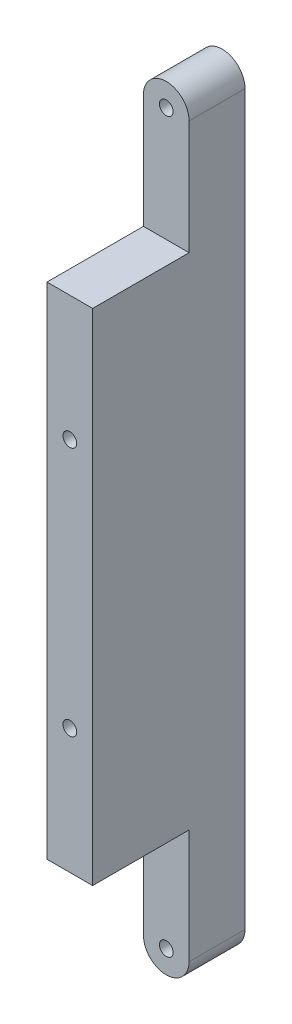
from build123d import *

# Parameters (mm, degrees)
SKETCH_1_R          = 2
SKETCH_1_R_2        = 0.6
EXTRUDE_1_DEPTH     = 20
SKETCH_4_W          = 4
SKETCH_4_H          = 20
EXTRUDE_2_DEPTH     = 10
SKETCH_3_W          = 4
SKETCH_3_H          = 10.2
CUT_EXTRUDE_1_DEPTH = 24.409399821
EXTRUDE_START       = 10
SKETCH_4_2_W        = 4
SKETCH_4_2_H        = 20
EXTRUDE_3_DEPTH     = 3
SKETCH_1_4_R        = 0.6
CUT_EXTRUDE_3_DEPTH = 24.937418407
SKETCH_5_W          = 4
SKETCH_5_H          = 18.9
EXTRUDE_4_DEPTH     = 20
SKETCH_6_W          = 6.65
SKETCH_6_H          = 67.8
CUT_EXTRUDE_4_DEPTH = 69.888605734
SKETCH_7_R          = 0.6
CUT_EXTRUDE_5_DEPTH = 3


with BuildPart() as part:
    # 草图1 → 凸台-拉伸1 (new body)
    with BuildSketch(Plane.XY):
        Circle(SKETCH_1_R)
        Circle(SKETCH_1_R_2, mode=Mode.SUBTRACT)
    extrude(amount=EXTRUDE_1_DEPTH)

    # 草图4 → 凸台-拉伸2 (add)
    with BuildSketch(Plane(origin=(0, 0, 0), x_dir=(1, 0, 0), z_dir=(0, 1, 0))):
        with Locations((0, -10)):
            Rectangle(SKETCH_4_W, SKETCH_4_H)
    extrude(amount=EXTRUDE_2_DEPTH)

    # 草图3 → 切除-拉伸1 (cut, through all)
    with BuildSketch(Plane(origin=(0, 10, 0), x_dir=(1, 0, 0), z_dir=(0, 1, 0))):
        with Locations((0, -10)):
            Rectangle(SKETCH_3_W, SKETCH_3_H)
    extrude(amount=-CUT_EXTRUDE_1_DEPTH, mode=Mode.SUBTRACT)


with BuildPart() as cut_extrude_1_piece_1:
    # of the separate pieces the step leaves, piece 1, a body of its own (cut_extrude_1_pieces)
    add(part.part.solids().sort_by_distance((-2, 0, 0))[0])



with BuildPart() as cut_extrude_1_piece_2:
    # of the separate pieces the step leaves, piece 2, a body of its own (cut_extrude_1_pieces)
    add(part.part.solids().sort_by_distance((2, 0, 15.1))[0])


with BuildPart() as cut_extrude_1_piece_1_1:
    add(cut_extrude_1_piece_1.part)

    add(cut_extrude_1_piece_2.part)  # 凸台-拉伸3 merges 切除-拉伸1 piece 2
    # 草图4<2> → 凸台-拉伸3 (add)
    with BuildSketch(Plane(origin=(0, 0, 0), x_dir=(1, 0, 0), z_dir=(0, 1, 0)).offset(EXTRUDE_START)):
        with Locations((0, -10)):
            Rectangle(SKETCH_4_2_W, SKETCH_4_2_H)
    extrude(amount=EXTRUDE_3_DEPTH)

    # 草图1<4> → 切除-拉伸3 (cut, through all)
    with BuildSketch(Plane.XY):
        with Locations(Location((0, 0, 0), (0, 0, 180))):
            Circle(SKETCH_1_4_R)
    extrude(amount=CUT_EXTRUDE_3_DEPTH, mode=Mode.SUBTRACT)

    # 草图5 → 凸台-拉伸4 (add)
    with BuildSketch(Plane(origin=(0, 0, 0), x_dir=(-1, 0, 0), z_dir=(0, 0, -1))):
        with Locations((0, 22.45)):
            Rectangle(SKETCH_5_W, SKETCH_5_H)
    extrude(amount=-EXTRUDE_4_DEPTH)

    # 镜向1: 切除-拉伸1 piece 1 across plane


with BuildPart() as cut_extrude_1_piece_1_2:
    add(cut_extrude_1_piece_1_1.part)
    add(cut_extrude_1_piece_1_1.part.mirror(Plane(origin=(2, 31.9, 39.318643845), x_dir=(0, 0, 1), z_dir=(0, 1, 0))))

    # 草图6 → 切除-拉伸4 (cut, through all)
    with BuildSketch(Plane.ZY.offset(2)):
        with Locations((16.675, 31.9)):
            Rectangle(SKETCH_6_W, SKETCH_6_H)
    extrude(amount=-CUT_EXTRUDE_4_DEPTH, mode=Mode.SUBTRACT)

    # 草图7 → 切除-拉伸5 (cut)
    with BuildSketch(Plane.XY.offset(13.35)):
        with Locations((0, 42.85)):
            Circle(SKETCH_7_R)
        with Locations((0, 20.95)):
            Circle(SKETCH_7_R)
    extrude(amount=-CUT_EXTRUDE_5_DEPTH, mode=Mode.SUBTRACT)


solid = cut_extrude_1_piece_1_2.part
